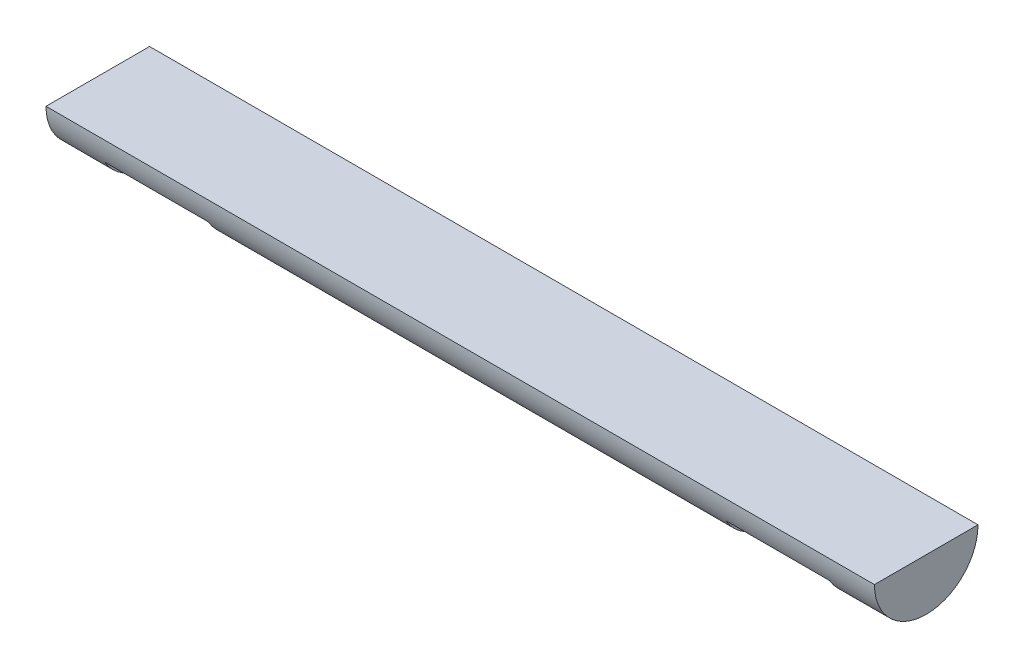
from build123d import *

# Parameters (mm, degrees)
BASE_DEPTH      = 2743.2
SKETCH2_W       = 304.8
SKETCH2_H       = 76.2
LEFT_SLOT_DEPTH = 2752.653640995
LEFT_CUT_DEPTH  = 152.4


with BuildPart() as part:
    # Sketch1 → Base (new body)
    with BuildSketch(Plane(origin=(0, 0, 0), x_dir=(0, 0, -1), z_dir=(1, 0, 0))):
        with BuildLine():
            Line((152.4, 0), (-152.4, 0))
            ThreePointArc((-152.4, 0), (0, -152.4), (152.4, 0))
        make_face()
    extrude(amount=BASE_DEPTH)

    # Sketch2 → Left Slot (cut, symmetric)
    with BuildSketch(Plane.XY):
        with Locations((457.2, -114.3)):
            Rectangle(SKETCH2_W, SKETCH2_H)
    left_slot = extrude(amount=LEFT_SLOT_DEPTH, both=True, mode=Mode.SUBTRACT)

    # Right Slot: Left Slot across plane
    add(left_slot.mirror(Plane(origin=(1371.6, 0, 0), x_dir=(0, 0, 1), z_dir=(1, 0, 0))), mode=Mode.SUBTRACT)

    # Sketch3 → Left Cut (cut)
    with BuildSketch(Plane.ZY):
        with BuildLine():
            Line((152.4, 0), (-152.4, 0))
            ThreePointArc((-152.4, 0), (0, -152.4), (152.4, 0))
        make_face()
    left_cut = extrude(amount=-LEFT_CUT_DEPTH, mode=Mode.SUBTRACT)

    # Right Cut: Left Cut across plane
    add(left_cut.mirror(Plane(origin=(1371.6, 0, 0), x_dir=(0, 0, 1), z_dir=(1, 0, 0))), mode=Mode.SUBTRACT)


solid = part.part
